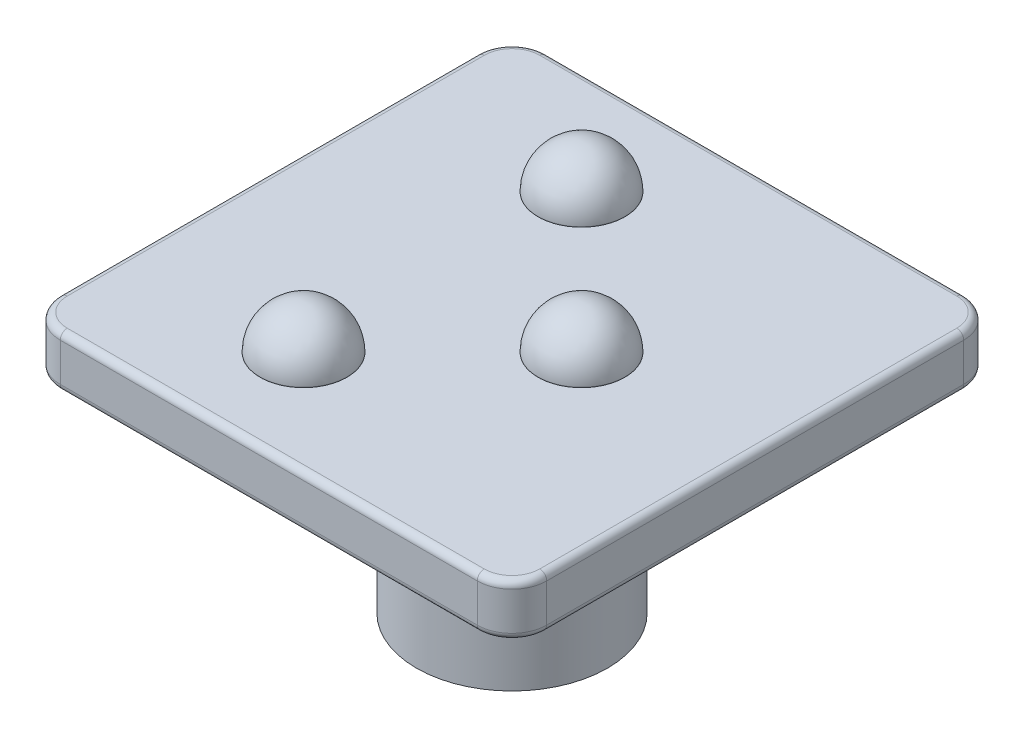
from build123d import *

# Parameters (mm, degrees)
BOSS_EXTRUDE1_DEPTH = 1.5
SKETCH2_R           = 2.75
BOSS_EXTRUDE2_DEPTH = 6
SKETCH3_W           = 1.1
SKETCH3_H           = 1.45
SKETCH3_W_2         = 1.45
SKETCH3_H_2         = 1.1
CUT_EXTRUDE1_DEPTH  = 6
CHAMFER1_SIZE       = 0.3
FILLET1_R           = 1
SKETCH4_R           = 1.25
BOSS_EXTRUDE3_DEPTH = 0.01
DOME1_FACE_RADIUS   = 1.25
DOME1_HEIGHT        = 1.25
DOME4_FACE_RADIUS   = 1.25
DOME4_HEIGHT        = 1.25
DOME5_FACE_RADIUS   = 1.25
DOME5_HEIGHT        = 1.25
FILLET3_R           = 0.2


with BuildPart() as part:
    # Sketch1 → Boss-Extrude1 (new body)
    with BuildSketch(Plane(origin=(0, 0, 0), x_dir=(1, 0, 0), z_dir=(0, 1, 0))):
        with BuildLine():
            Line((-7.324675649, 4.396717546), (4.675324351, 4.396717546))
            ThreePointArc((4.675324351, 4.396717546), (5.382431132, 4.103824327), (5.675324351, 3.396717546))
            Line((5.675324351, 3.396717546), (5.675324351, -8.603282454))
            ThreePointArc((5.675324351, -8.603282454), (5.382431132, -9.310389235), (4.675324351, -9.603282454))
            Line((4.675324351, -9.603282454), (-7.324675649, -9.603282454))
            ThreePointArc((-7.324675649, -9.603282454), (-8.03178243, -9.310389235), (-8.324675649, -8.603282454))
            Line((-8.324675649, -8.603282454), (-8.324675649, 3.396717546))
            ThreePointArc((-8.324675649, 3.396717546), (-8.03178243, 4.103824327), (-7.324675649, 4.396717546))
        make_face()
    extrude(amount=BOSS_EXTRUDE1_DEPTH)

    # Sketch2 → Boss-Extrude2 (add)
    with BuildSketch(Plane.XZ):
        with Locations(Location((-1.324675649, 2.603282454, 0), (0, 0, 270))):
            Circle(SKETCH2_R)
    extrude(amount=BOSS_EXTRUDE2_DEPTH)

    # Sketch3 → Cut-Extrude1 (cut)
    with BuildSketch(Plane.XZ.offset(6)):
        with Locations((-1.324675649, 3.878282454)):
            Rectangle(SKETCH3_W, SKETCH3_H)
        with Locations((-0.049675649, 2.603282454)):
            Rectangle(SKETCH3_W_2, SKETCH3_H_2)
        with Locations((-1.324675649, 2.603282454)):
            Rectangle(SKETCH3_W, SKETCH3_H_2)
        with Locations((-2.599675649, 2.603282454)):
            Rectangle(SKETCH3_W_2, SKETCH3_H_2)
        with Locations((-1.324675649, 1.328282454)):
            Rectangle(SKETCH3_W, SKETCH3_H)
    extrude(amount=-CUT_EXTRUDE1_DEPTH, mode=Mode.SUBTRACT)

    # Chamfer1
    chamfer1_edges = [part.edges().sort_by_distance(p)[0] for p in [
        (-0.774675649, -6, 3.878282454),
        (-0.049675649, -6, 3.153282454),
        (0.675324351, -6, 2.603282454),
        (-0.774675649, -6, 1.328282454),
        (-2.599675649, -6, 3.153282454),
        (-1.324675649, -6, 4.603282454),
        (-1.874675649, -6, 3.878282454),
        (-3.324675649, -6, 2.603282454),
        (-2.599675649, -6, 2.053282454),
        (-1.874675649, -6, 1.328282454),
        (-1.324675649, -6, 0.603282454),
        (-0.049675649, -6, 2.053282454),
    ]]
    chamfer(chamfer1_edges, length=CHAMFER1_SIZE)

    # Fillet1
    fillet1_edges = [part.edges().sort_by_distance(p)[0] for p in [
        (-1.324675649, 0, 5.353282454),
    ]]
    fillet(fillet1_edges, radius=FILLET1_R)

    # Sketch4 → Boss-Extrude3 (add)
    with BuildSketch(Plane(origin=(0, 1.5, 0), x_dir=(1, 0, 0), z_dir=(0, 1, 0))):
        with Locations(Location((-3.324675649, 1.396717546, 0), (0, 0, 90))):
            Circle(SKETCH4_R)
        with Locations(Location((0.675324351, -2.603282454, 0), (0, 0, 90))):
            Circle(SKETCH4_R)
        with Locations(Location((-3.324675649, -6.603282454, 0), (0, 0, 90))):
            Circle(SKETCH4_R)
    extrude(amount=BOSS_EXTRUDE3_DEPTH)

    # Dome1: a dome of height H over a round flat face of radius A is a cap of a sphere of radius (A * A + H * H) / (2 * H)
    dome1_r = (DOME1_FACE_RADIUS * DOME1_FACE_RADIUS + DOME1_HEIGHT * DOME1_HEIGHT) / (2 * DOME1_HEIGHT)
    dome1_base = Plane((-3.324675649, 1.51, -1.396717546), z_dir=(0, 1, 0))
    with Locations(dome1_base.offset(DOME1_HEIGHT - dome1_r)):
        dome1_ball = Sphere(dome1_r, mode=Mode.PRIVATE)
    add(split(dome1_ball, bisect_by=dome1_base, keep=Keep.TOP, mode=Mode.PRIVATE))

    # Dome4: a dome of height H over a round flat face of radius A is a cap of a sphere of radius (A * A + H * H) / (2 * H)
    dome4_r = (DOME4_FACE_RADIUS * DOME4_FACE_RADIUS + DOME4_HEIGHT * DOME4_HEIGHT) / (2 * DOME4_HEIGHT)
    dome4_base = Plane((0.675324351, 1.51, 2.603282454), z_dir=(0, 1, 0))
    with Locations(dome4_base.offset(DOME4_HEIGHT - dome4_r)):
        dome4_ball = Sphere(dome4_r, mode=Mode.PRIVATE)
    add(split(dome4_ball, bisect_by=dome4_base, keep=Keep.TOP, mode=Mode.PRIVATE))

    # Dome5: a dome of height H over a round flat face of radius A is a cap of a sphere of radius (A * A + H * H) / (2 * H)
    dome5_r = (DOME5_FACE_RADIUS * DOME5_FACE_RADIUS + DOME5_HEIGHT * DOME5_HEIGHT) / (2 * DOME5_HEIGHT)
    dome5_base = Plane((-3.324675649, 1.51, 6.603282454), z_dir=(0, 1, 0))
    with Locations(dome5_base.offset(DOME5_HEIGHT - dome5_r)):
        dome5_ball = Sphere(dome5_r, mode=Mode.PRIVATE)
    add(split(dome5_ball, bisect_by=dome5_base, keep=Keep.TOP, mode=Mode.PRIVATE))

    # Fillet3
    fillet3_edges = [part.edges().sort_by_distance(p)[0] for p in [
        (5.382431132, 1.5, 9.310389235),
        (-1.324675649, 0, 9.603282454),
        (-8.03178243, 0, 9.310389235),
        (5.675324351, 1.5, 2.603282454),
        (5.382431132, 1.5, -4.103824327),
        (-1.324675649, 1.5, -4.396717546),
        (-8.03178243, 1.5, -4.103824327),
        (-8.324675649, 1.5, 2.603282454),
        (-8.03178243, 1.5, 9.310389235),
        (-1.324675649, 1.5, 9.603282454),
        (-8.324675649, 0, 2.603282454),
        (-8.03178243, 0, -4.103824327),
        (-1.324675649, 0, -4.396717546),
        (5.382431132, 0, -4.103824327),
        (5.675324351, 0, 2.603282454),
        (5.382431132, 0, 9.310389235),
    ]]
    fillet(fillet3_edges, radius=FILLET3_R)


solid = part.part
